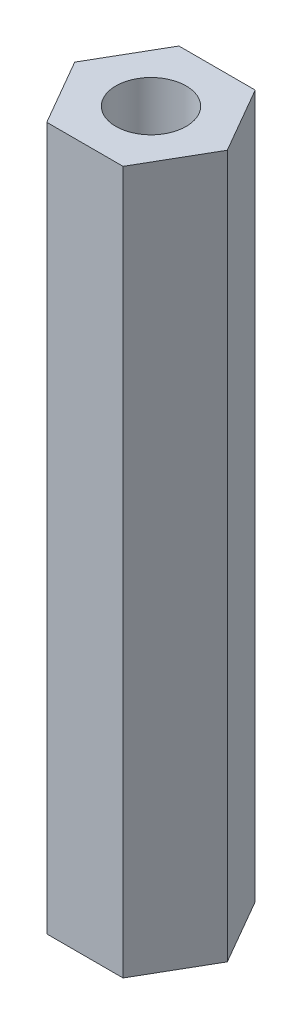
from build123d import *

# Parameters (mm, degrees)
SKETCH1_R           = 1.25
BOSS_EXTRUDE1_DEPTH = 25


with BuildPart() as part:
    # Sketch1 → Boss-Extrude1 (new body)
    with BuildSketch(Plane(origin=(0, 0, 0), x_dir=(1, 0, 0), z_dir=(0, 1, 0))):
        Polygon((1.356773133, 2.35), (-1.356773133, 2.35), (-2.713546265, 0), (-1.356773133, -2.35), (1.356773133, -2.35), (2.713546265, 0), align=None)
        with Locations(Location((0, 0, 0), (0, 0, 270))):
            Circle(SKETCH1_R, mode=Mode.SUBTRACT)
    extrude(amount=BOSS_EXTRUDE1_DEPTH)


solid = part.part
